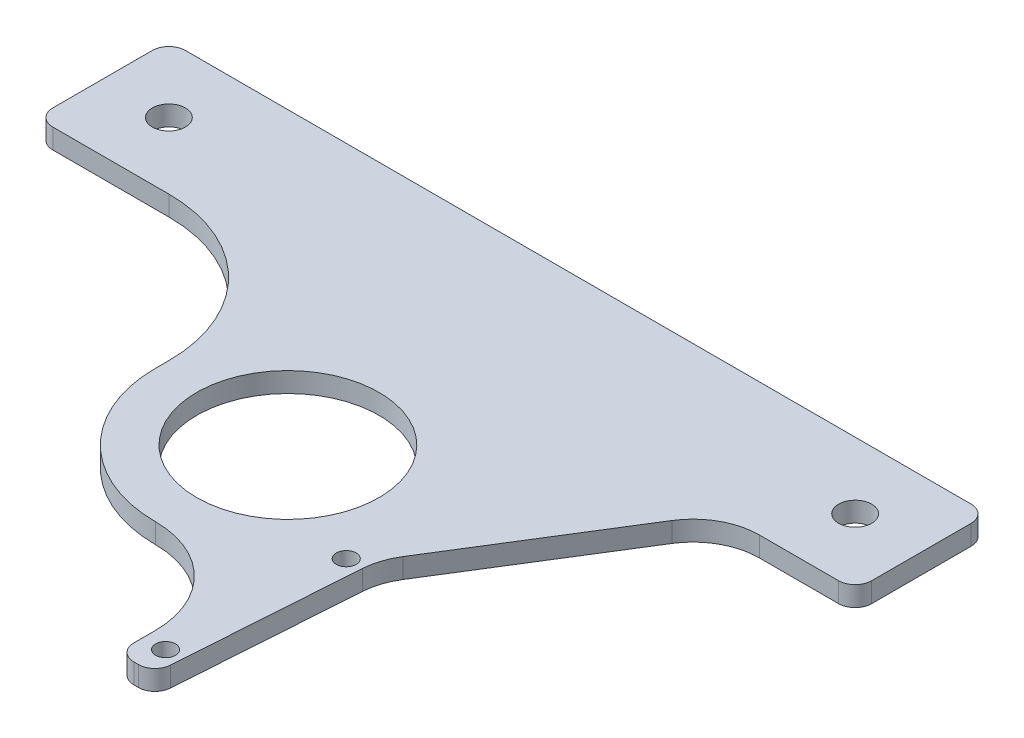
from build123d import *

# Parameters (mm, degrees)
SKETCH1_R           = 27.5
SKETCH1_R_2         = 3
SKETCH1_R_3         = 5
BOSS_EXTRUDE1_DEPTH = 6
FILLET1_R           = 5


with BuildPart() as part:
    # Sketch1 → Boss-Extrude1 (new body)
    with BuildSketch(Plane(origin=(0, 0, 0), x_dir=(1, 0, 0), z_dir=(0, 1, 0))):
        with BuildLine():
            Line((-123.5, 87.6), (123.5, 87.6))
            Line((123.5, 87.6), (123.5, 47.6))
            Line((123.5, 47.6), (94.604107801, 47.6))
            ThreePointArc((94.604107801, 47.6), (84.895928348, 45.085744243), (77.628633504, 38.175125172))
            Line((77.628633504, 38.175125172), (46.48038696, -11.824874828))
            ThreePointArc((46.48038696, -11.824874828), (44.426515721, -16.245001343), (43.502792816, -21.030671774))
            Line((43.502792816, -21.030671774), (39.782384757, -75.242332057))
            ThreePointArc((39.782384757, -75.242332057), (38.206473118, -78.554562921), (34.794117647, -79.9))
            Line((34.794117647, -79.9), (33.462740879, -79.9))
            ThreePointArc((33.462740879, -79.9), (29.927206973, -78.435533906), (28.462740879, -74.9))
            Line((28.462740879, -74.9), (28.462740879, -68.462740879))
            ThreePointArc((28.462740879, -68.462740879), (20.126197087, -48.336543792), (0, -40))
            ThreePointArc((0, -40), (-28.284271247, -28.284271247), (-40, 0))
            Line((-40, 0), (-40, 4.1))
            ThreePointArc((-40, 4.1), (-52.740855018, 34.859144982), (-83.5, 47.6))
            Line((-83.5, 47.6), (-123.5, 47.6))
            Line((-123.5, 47.6), (-123.5, 87.6))
        make_face()
        with Locations(Location((0, 0, 0), (0, 0, 270))):
            Circle(SKETCH1_R, mode=Mode.SUBTRACT)
        with Locations(Location((38.5, -20.9, 0), (0, 0, 270))):
            Circle(SKETCH1_R_2, mode=Mode.SUBTRACT)
        with Locations(Location((35, -71.9, 0), (0, 0, 270))):
            Circle(SKETCH1_R_2, mode=Mode.SUBTRACT)
        with Locations(Location((-103.5, 67.6, 0), (0, 0, 270))):
            Circle(SKETCH1_R_3, mode=Mode.SUBTRACT)
        with Locations(Location((103.5, 67.6, 0), (0, 0, 90))):
            Circle(SKETCH1_R_3, mode=Mode.SUBTRACT)
    extrude(amount=BOSS_EXTRUDE1_DEPTH)

    # Fillet1
    fillet1_edges = [part.edges().sort_by_distance(p)[0] for p in [
        (-123.5, 3, -87.6),
        (123.5, 3, -87.6),
        (123.5, 3, -47.6),
        (-123.5, 3, -47.6),
    ]]
    fillet(fillet1_edges, radius=FILLET1_R)


solid = part.part
